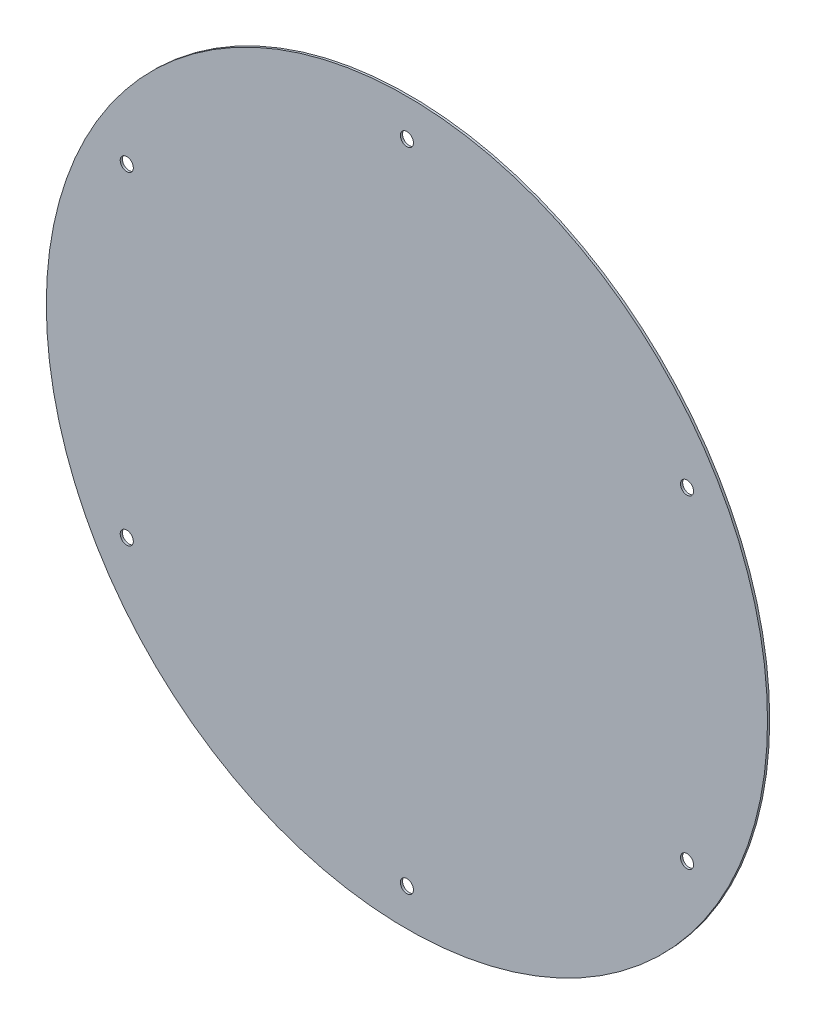
from build123d import *

# Parameters (mm, degrees)
SKETCH1_R           = 82.5
SKETCH1_R_2         = 1.5
BOSS_EXTRUDE1_DEPTH = 0.5


with BuildPart() as part:
    # Sketch1 → Boss-Extrude1 (new body)
    with BuildSketch(Plane.XY):
        Circle(SKETCH1_R)
        with Locations((0, 74)):
            Circle(SKETCH1_R_2, mode=Mode.SUBTRACT)
        with Locations((0, -74)):
            Circle(SKETCH1_R_2, mode=Mode.SUBTRACT)
        with Locations((64.08587988, 37)):
            Circle(SKETCH1_R_2, mode=Mode.SUBTRACT)
        with Locations((64.08587988, -37)):
            Circle(SKETCH1_R_2, mode=Mode.SUBTRACT)
        with Locations((-64.08587988, -37)):
            Circle(SKETCH1_R_2, mode=Mode.SUBTRACT)
        with Locations((-64.08587988, 37)):
            Circle(SKETCH1_R_2, mode=Mode.SUBTRACT)
    extrude(amount=BOSS_EXTRUDE1_DEPTH)


solid = part.part
